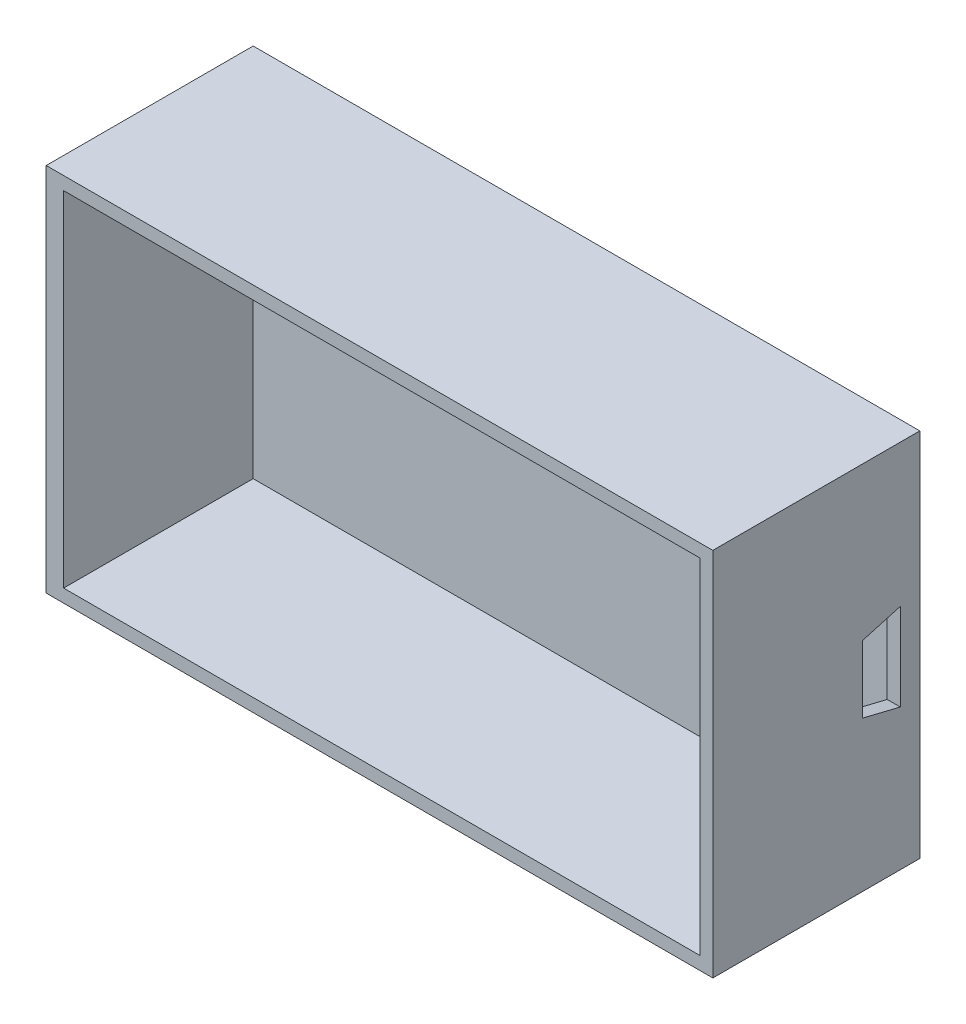
from build123d import *

# Parameters (mm, degrees)
IZIM1_W                     = 58.4
IZIM1_H                     = 31.6
Y_KSEKLIK_EKSTR_ZYON1_DEPTH = 19
IZIM2_W                     = 58.4
IZIM2_H                     = 31.6
Y_KSEKLIK_EKSTR_ZYON2_DEPTH = 1.6
KES_EKSTR_ZYON2_START       = 59.6
KES_EKSTR_ZYON2_DEPTH       = 3


with BuildPart() as part:
    # Çizim1 → Yükseklik-Ekstrüzyon1 (new body)
    with BuildSketch(Plane.XY):
        Polygon((0, 32.8), (59.6, 32.8), (59.6, -1.2), (-1.6, -1.2), (-1.6, 32.8), align=None)
        with Locations((29.2, 15.8)):
            Rectangle(IZIM1_W, IZIM1_H, mode=Mode.SUBTRACT)
    extrude(amount=Y_KSEKLIK_EKSTR_ZYON1_DEPTH)

    # Çizim2 → Yükseklik-Ekstrüzyon2 (add)
    with BuildSketch(Plane.XY):
        with Locations((29.2, 15.8)):
            Rectangle(IZIM2_W, IZIM2_H)
    extrude(amount=Y_KSEKLIK_EKSTR_ZYON2_DEPTH)

    # Çizim3 → Kes-Ekstrüzyon2 (cut)
    with BuildSketch(Plane(origin=(0, 0, 0), x_dir=(0, 0, -1), z_dir=(1, 0, 0)).offset(KES_EKSTR_ZYON2_START)):
        Polygon((-1.790149403, 19.741982838), (-1.790149403, 11.741982838), (-5.27887078, 12.594196568), (-5.27887078, 18.754449839), align=None)
    extrude(amount=-KES_EKSTR_ZYON2_DEPTH, mode=Mode.SUBTRACT)


solid = part.part
